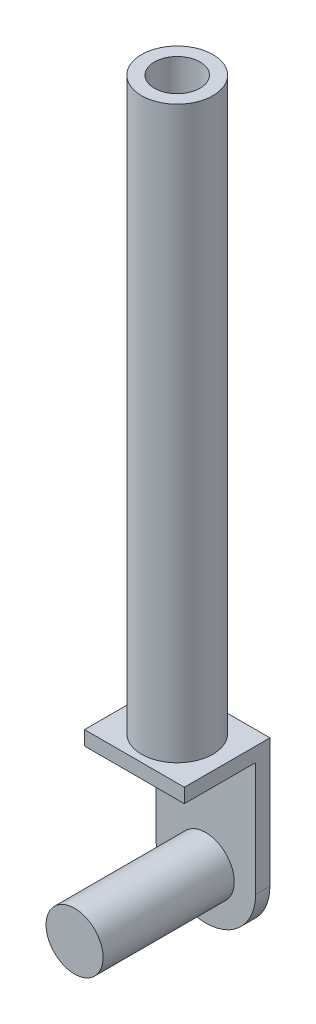
from build123d import *

# Parameters (mm, degrees)
EXTRUDE_1_DEPTH = 5
SKETCH_2_R      = 10
EXTRUDE_2_DEPTH = 46
SKETCH_4_W      = 35
SKETCH_4_H      = 30
EXTRUDE_3_DEPTH = 5
SKETCH_5_R      = 12.5
SKETCH_5_R_2    = 8
EXTRUDE_4_DEPTH = 200


with BuildPart() as part:
    # 草图1 → 凸台-拉伸1 (new body)
    with BuildSketch(Plane.XY):
        with BuildLine():
            Line((-17.5, 0), (-17.5, 40))
            Line((-17.5, 40), (17.5, 40))
            Line((17.5, 40), (17.5, 0))
            ThreePointArc((17.5, 0), (0, -17.5), (-17.5, 0))
        make_face()
    extrude(amount=EXTRUDE_1_DEPTH)

    # 草图2 → 凸台-拉伸2 (add)
    with BuildSketch(Plane.XY.offset(5)):
        Circle(SKETCH_2_R)
    extrude(amount=EXTRUDE_2_DEPTH)

    # 草图4 → 凸台-拉伸3 (add)
    with BuildSketch(Plane(origin=(0, 40, 0), x_dir=(1, 0, 0), z_dir=(0, 1, 0))):
        with Locations((0, -15)):
            Rectangle(SKETCH_4_W, SKETCH_4_H)
    extrude(amount=EXTRUDE_3_DEPTH)

    # 草图5 → 凸台-拉伸4 (add)
    with BuildSketch(Plane(origin=(0, 45, 0), x_dir=(1, 0, 0), z_dir=(0, 1, 0))):
        with Locations(Location((0, -15, 0), (0, 0, 270))):
            Circle(SKETCH_5_R)
        with Locations(Location((0, -15, 0), (0, 0, 270))):
            Circle(SKETCH_5_R_2, mode=Mode.SUBTRACT)
    extrude(amount=EXTRUDE_4_DEPTH)


solid = part.part
